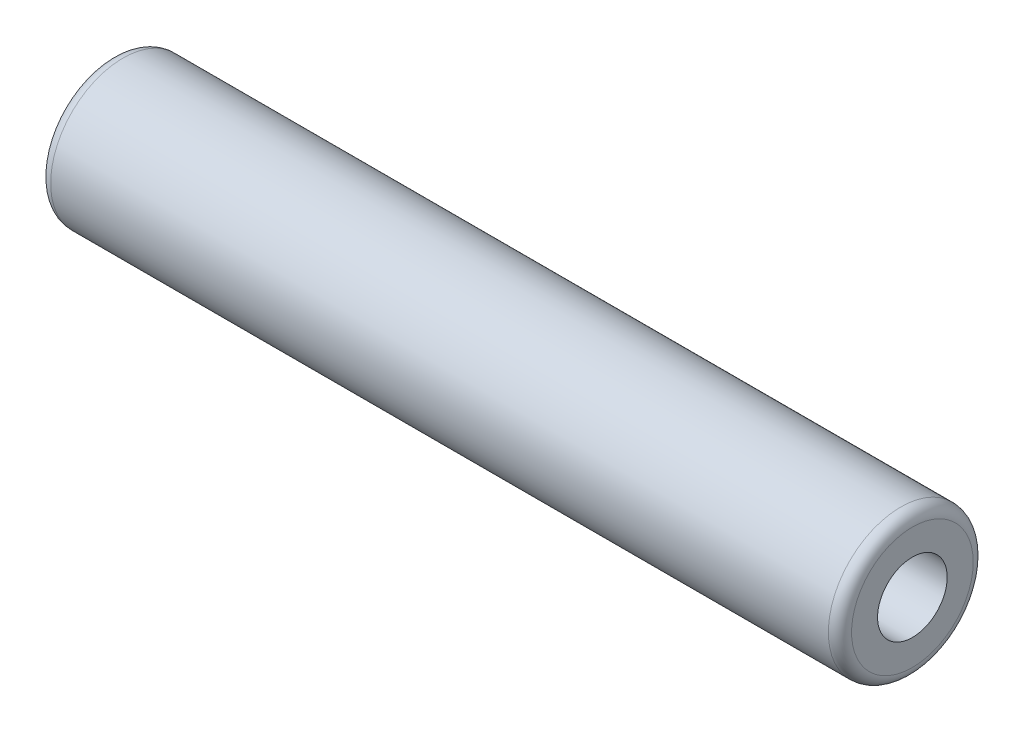
from build123d import *

# Parameters (mm, degrees)
SKETCH1_R           = 9.906
SKETCH1_R_2         = 4.7625
BOSS_EXTRUDE1_DEPTH = 109.5375
FILLET1_R           = 1.5875


with BuildPart() as part:
    # Sketch1 → Boss-Extrude1 (new body)
    with BuildSketch(Plane(origin=(0, 0, 0), x_dir=(0, 0, -1), z_dir=(1, 0, 0))):
        Circle(SKETCH1_R)
        Circle(SKETCH1_R_2, mode=Mode.SUBTRACT)
    extrude(amount=BOSS_EXTRUDE1_DEPTH)

    # Fillet1
    fillet1_edges = [part.edges().sort_by_distance(p)[0] for p in [
        (0, 0, 9.906),
        (109.5375, 0, 9.906),
    ]]
    fillet(fillet1_edges, radius=FILLET1_R)


solid = part.part
